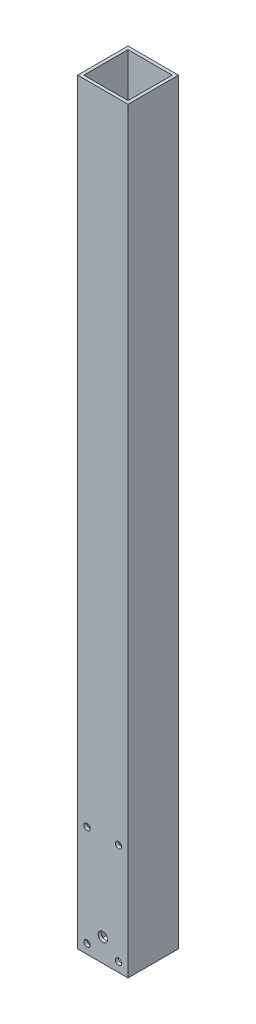
from build123d import *

# Parameters (mm, degrees)
SKETCH1_W           = 50.8
SKETCH1_H           = 50.8
SKETCH1_W_2         = 44.45
SKETCH1_H_2         = 44.45
BOSS_EXTRUDE1_DEPTH = 762
SKETCH2_R           = 3.175
SKETCH2_R_2         = 4.7625
CUT_EXTRUDE1_DEPTH  = 766.379174005


with BuildPart() as part:
    # Sketch1 → Boss-Extrude1 (new body)
    with BuildSketch(Plane(origin=(0, 0, 0), x_dir=(1, 0, 0), z_dir=(0, 1, 0))):
        with Locations((25.4, 25.4)):
            Rectangle(SKETCH1_W, SKETCH1_H)
        with Locations((25.4, 25.4)):
            Rectangle(SKETCH1_W_2, SKETCH1_H_2, mode=Mode.SUBTRACT)
    extrude(amount=BOSS_EXTRUDE1_DEPTH)

    # Sketch2 → Cut-Extrude1 (cut, through all)
    with BuildSketch(Plane.XY):
        with Locations((9.525, 111.125)):
            Circle(SKETCH2_R)
        with Locations((41.275, 111.125)):
            Circle(SKETCH2_R)
        with Locations((9.525, 9.525)):
            Circle(SKETCH2_R)
        with Locations((41.275, 9.525)):
            Circle(SKETCH2_R)
        with Locations((25.4, 23.114)):
            Circle(SKETCH2_R_2)
    extrude(amount=-CUT_EXTRUDE1_DEPTH, mode=Mode.SUBTRACT)


solid = part.part
